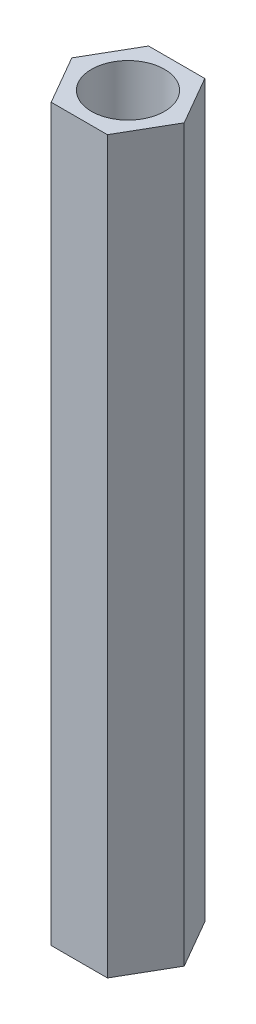
from build123d import *

# Parameters (mm, degrees)
SKETCH1_R           = 1.5
BOSS_EXTRUDE1_DEPTH = 30


with BuildPart() as part:
    # Sketch1 → Boss-Extrude1 (new body)
    with BuildSketch(Plane(origin=(0, 0, 0), x_dir=(1, 0, 0), z_dir=(0, 1, 0))):
        Polygon((2.309401077, 0), (1.154700538, 2), (-1.154700538, 2), (-2.309401077, 0), (-1.154700538, -2), (1.154700538, -2), align=None)
        with Locations(Location((0, 0, 0), (0, 0, 270))):
            Circle(SKETCH1_R, mode=Mode.SUBTRACT)
    extrude(amount=BOSS_EXTRUDE1_DEPTH)


solid = part.part
